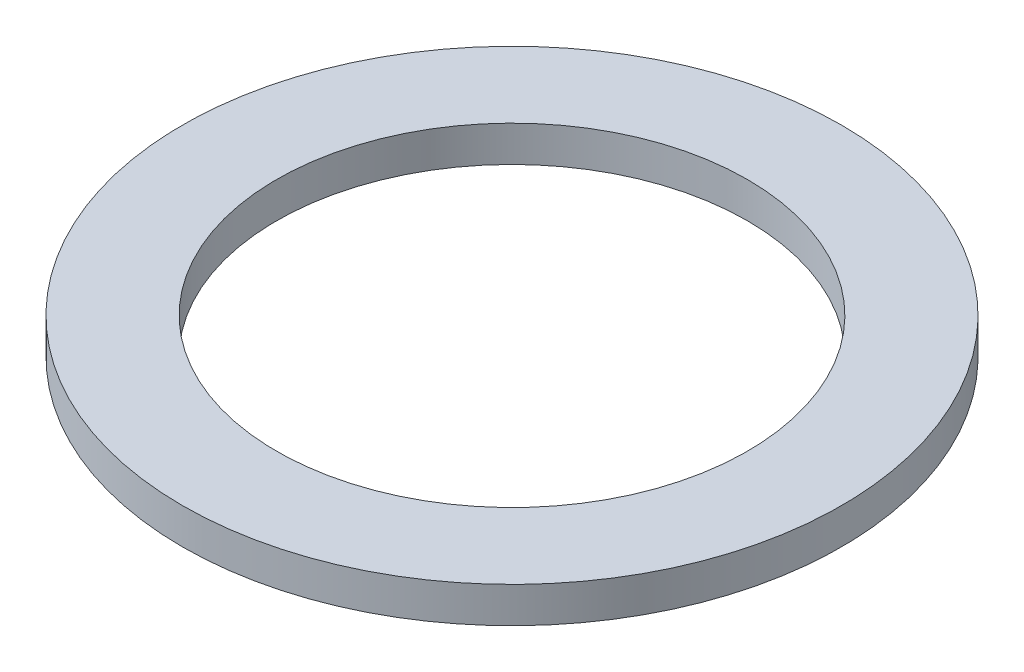
from build123d import *

# Parameters (mm, degrees)
SKETCH1_R           = 8.89
SKETCH1_R_2         = 6.35
BOSS_EXTRUDE1_DEPTH = 0.9652


with BuildPart() as part:
    # Sketch1 → Boss-Extrude1 (new body)
    with BuildSketch(Plane(origin=(0, 0, 0), x_dir=(1, 0, 0), z_dir=(0, 1, 0))):
        with Locations(Location((0, 0, 0), (0, 0, 90))):
            Circle(SKETCH1_R)
        with Locations(Location((0, 0, 0), (0, 0, 90))):
            Circle(SKETCH1_R_2, mode=Mode.SUBTRACT)
    extrude(amount=BOSS_EXTRUDE1_DEPTH)


solid = part.part
